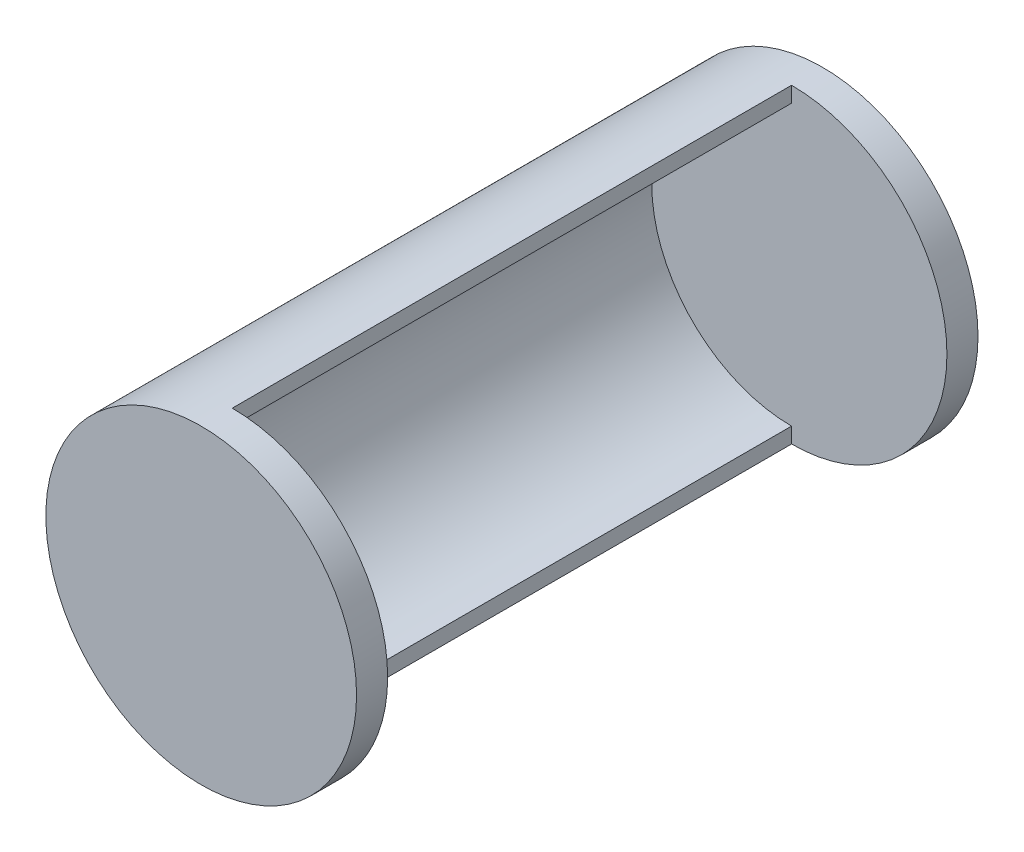
from build123d import *

# Parameters (mm, degrees)
SKETCH1_R           = 50
BOSS_EXTRUDE1_DEPTH = 10
BOSS_EXTRUDE2_DEPTH = 180
SKETCH3_R           = 50
BOSS_EXTRUDE3_DEPTH = 10


with BuildPart() as part:
    # Sketch1 → Boss-Extrude1 (new body)
    with BuildSketch(Plane(origin=(0, 0, 0), x_dir=(0, 1, 0), z_dir=(0, 0, 1))):
        with Locations(Location((0, 0, 0), (0, 0, 270))):
            Circle(SKETCH1_R)
    extrude(amount=BOSS_EXTRUDE1_DEPTH)

    # Sketch2 → Boss-Extrude2 (add)
    with BuildSketch(Plane.XY.offset(10)):
        with BuildLine():
            Line((0, 50), (0, 45))
            ThreePointArc((0, 45), (-45, 0), (0, -45))
            Line((0, -45), (0, -50))
            ThreePointArc((0, -50), (-50, 0), (0, 50))
        make_face()
    extrude(amount=BOSS_EXTRUDE2_DEPTH)

    # Sketch3 → Boss-Extrude3 (add)
    with BuildSketch(Plane.XY.offset(190)):
        Circle(SKETCH3_R)
    extrude(amount=BOSS_EXTRUDE3_DEPTH)


solid = part.part
